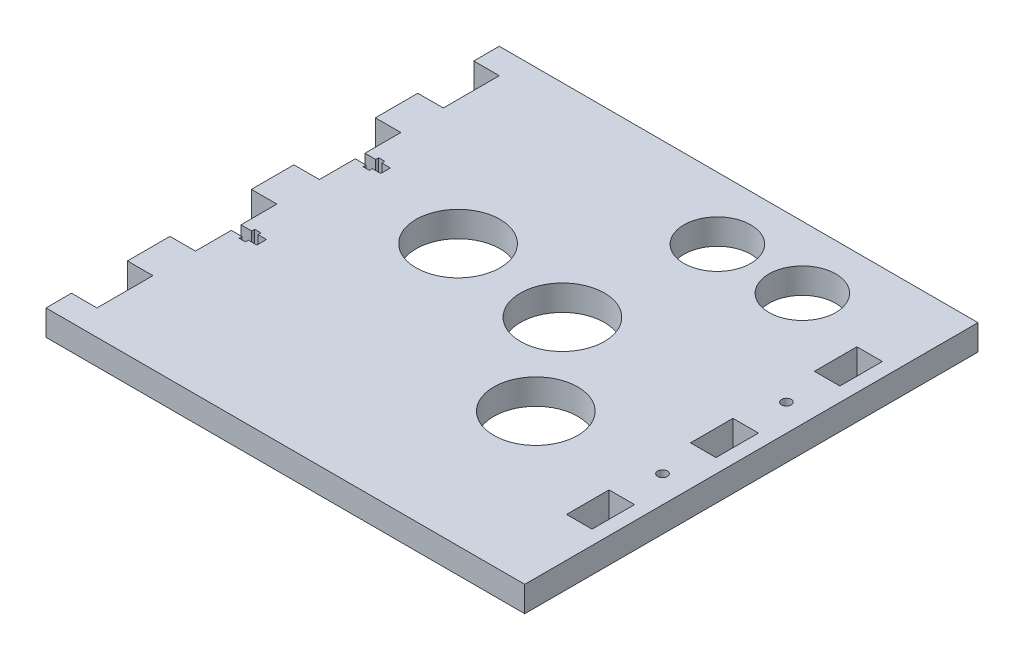
from build123d import *

# Parameters (mm, degrees)
SKETCH1_W           = 160
SKETCH1_H           = 160
BOSS_EXTRUDE1_DEPTH = 9
SKETCH2_W           = 9
SKETCH2_H           = 15
SKETCH2_H_2         = 9
BOSS_EXTRUDE2_DEPTH = 9
SKETCH3_R           = 1.7
SKETCH3_W           = 9
SKETCH3_H           = 15
CUT_EXTRUDE1_DEPTH  = 121.008333044
CUT_EXTRUDE2_DEPTH  = 121.008333044
SKETCH5_R           = 14.825
SKETCH5_R_2         = 11.8
CUT_EXTRUDE3_DEPTH  = 121.008333044


with BuildPart() as part:
    # Sketch1 → Boss-Extrude1 (new body)
    with BuildSketch(Plane(origin=(0, 0, 0), x_dir=(1, 0, 0), z_dir=(0, 1, 0))):
        Rectangle(SKETCH1_W, SKETCH1_H)
    extrude(amount=BOSS_EXTRUDE1_DEPTH)

    # Sketch2 → Boss-Extrude2 (add)
    with BuildSketch(Plane(origin=(0, 9, 0), x_dir=(1, 0, 0), z_dir=(0, 1, 0))):
        with Locations((-84.5, 0)):
            Rectangle(SKETCH2_W, SKETCH2_H)
        with Locations((-84.5, 43.75)):
            Rectangle(SKETCH2_W, SKETCH2_H)
        with Locations((-84.5, -43.75)):
            Rectangle(SKETCH2_W, SKETCH2_H)
        with Locations((-84.5, 75.5)):
            Rectangle(SKETCH2_W, SKETCH2_H_2)
        with Locations((-84.5, -75.5)):
            Rectangle(SKETCH2_W, SKETCH2_H_2)
    extrude(amount=-BOSS_EXTRUDE2_DEPTH)

    # Sketch3 → Cut-Extrude1 (cut, through all)
    with BuildSketch(Plane(origin=(0, 9, 0), x_dir=(1, 0, 0), z_dir=(0, 1, 0))):
        with Locations(Location((70.5, 21.875, 0), (0, 0, 270))):
            Circle(SKETCH3_R)
        with Locations(Location((70.5, -21.875, 0), (0, 0, 270))):
            Circle(SKETCH3_R)
        with Locations((70.5, 43.75)):
            Rectangle(SKETCH3_W, SKETCH3_H)
        with Locations((70.5, 0)):
            Rectangle(SKETCH3_W, SKETCH3_H)
        with Locations((70.5, -43.75)):
            Rectangle(SKETCH3_W, SKETCH3_H)
    extrude(amount=-CUT_EXTRUDE1_DEPTH, mode=Mode.SUBTRACT)

    # Sketch4 → Cut-Extrude2 (cut, through all)
    with BuildSketch(Plane(origin=(0, 9, 0), x_dir=(1, 0, 0), z_dir=(0, 1, 0))):
        Polygon((-80, 23.575), (-76.2, 23.575), (-76.2, 24.625), (-74, 24.625), (-74, 23.575), (-71, 23.575), (-71, 20.175), (-74, 20.175), (-74, 19.125), (-76.2, 19.125), (-76.2, 20.175), (-80, 20.175), align=None)
        Polygon((-80, -23.575), (-80, -20.175), (-76.2, -20.175), (-76.2, -19.125), (-74, -19.125), (-74, -20.175), (-71, -20.175), (-71, -23.575), (-74, -23.575), (-74, -24.625), (-76.2, -24.625), (-76.2, -23.575), align=None)
    extrude(amount=-CUT_EXTRUDE2_DEPTH, mode=Mode.SUBTRACT)

    # Sketch5 → Cut-Extrude3 (cut, through all)
    with BuildSketch(Plane.XZ):
        with Locations(Location((29.011898336, 25.108901907, 0), (0, 0, 270))):
            Circle(SKETCH5_R)
        with Locations(Location((5, -8.301270189, 0), (0, 0, 270))):
            Circle(SKETCH5_R)
        with Locations(Location((-35.940006948, -12.391098093, 0), (0, 0, 270))):
            Circle(SKETCH5_R)
        with Locations(Location((40, -58, 0), (0, 0, 270))):
            Circle(SKETCH5_R_2)
        with Locations(Location((10, -58, 0), (0, 0, 270))):
            Circle(SKETCH5_R_2)
    extrude(amount=-CUT_EXTRUDE3_DEPTH, mode=Mode.SUBTRACT)


solid = part.part
